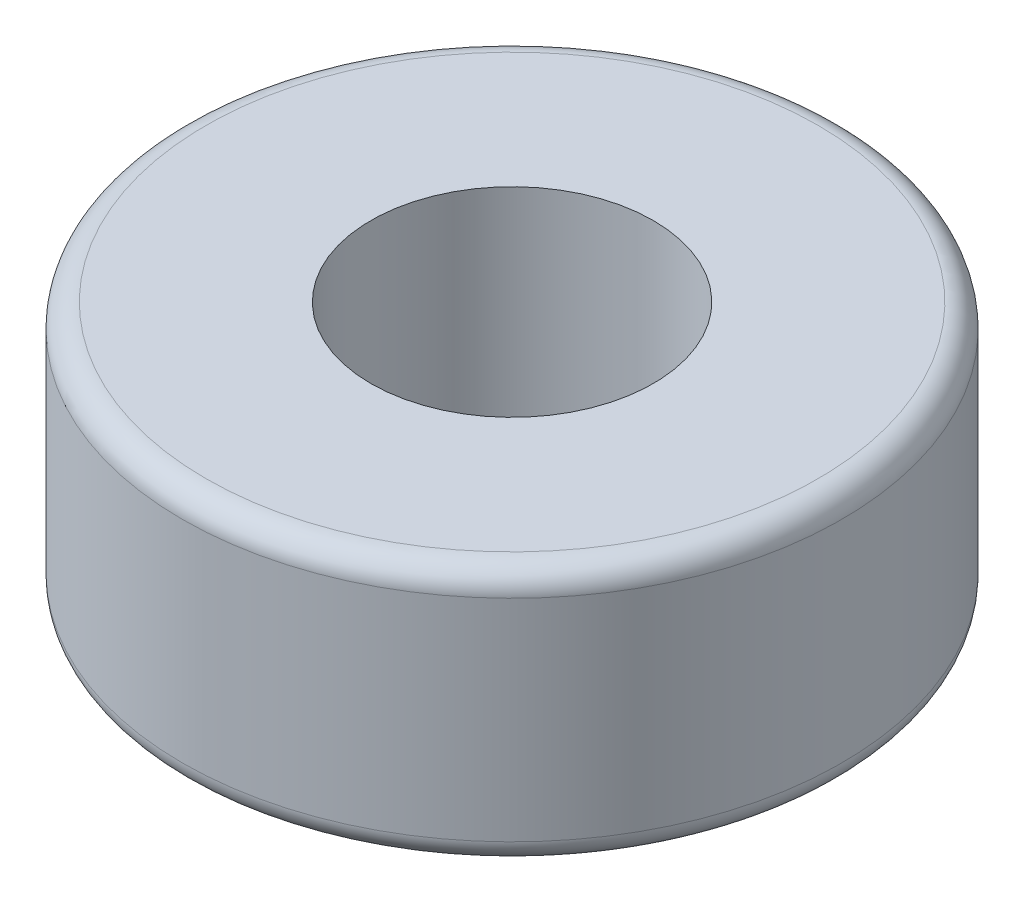
from build123d import *

# Parameters (mm, degrees)
ESQUISSE1_R        = 11.1125
ESQUISSE1_R_2      = 4.7625
BOSS_EXTRU_1_DEPTH = 4.34975
CONG_1_R           = 0.79375


with BuildPart() as part:
    # Esquisse1 → Boss.-Extru.1 (new, symmetric)
    with BuildSketch(Plane(origin=(0, 0, 0), x_dir=(1, 0, 0), z_dir=(0, 1, 0))):
        with Locations(Location((0, 0, 0), (0, 0, 270))):
            Circle(ESQUISSE1_R)
        with Locations(Location((0, 0, 0), (0, 0, 270))):
            Circle(ESQUISSE1_R_2, mode=Mode.SUBTRACT)
    extrude(amount=BOSS_EXTRU_1_DEPTH, both=True)

    # Congé1
    cong_1_edges = [part.edges().sort_by_distance(p)[0] for p in [
        (0, -4.34975, -11.1125),
        (0, 4.34975, -11.1125),
    ]]
    fillet(cong_1_edges, radius=CONG_1_R)


solid = part.part
